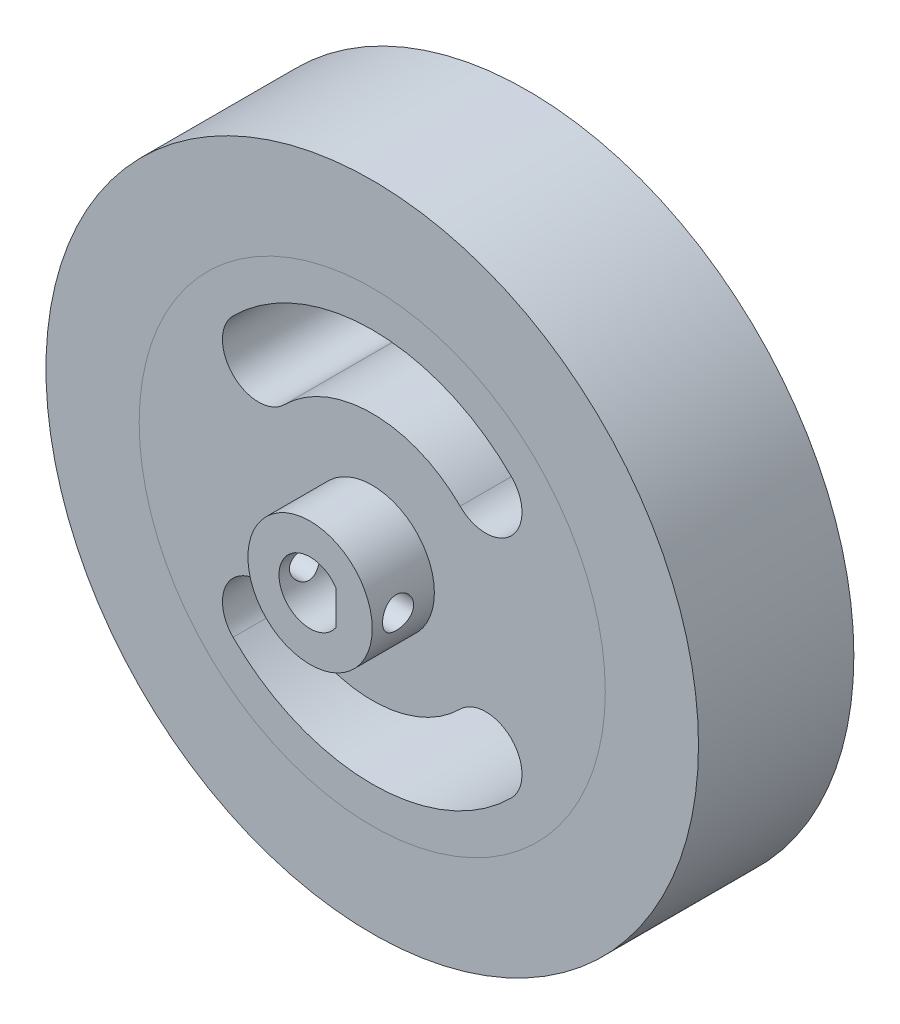
from build123d import *

# Parameters (mm, degrees)
SKETCH_1_R               = 31.5
EXTRUDE_1_DEPTH          = 15
SKETCH_3_R               = 3
CUT_EXTRUDE_2_DEPTH      = 48.005318848
SKETCH_14_R              = 6
SKETCH_14_R_2            = 3
EXTRUDE_3_DEPTH          = 6
EXTRUDE_START            = -21
EXTRUDE_4_DEPTH          = 21
CUT_EXTRUDE_3_DEPTH      = 50.249365478
CUT_EXTRUDE_3_DEPTH_BACK = 50.249365478
SKETCH_18_R              = 1.5
CUT_EXTRUDE_5_DEPTH      = 48.00531888
CUT_EXTRUDE_5_DEPTH_BACK = 48.00531888


with BuildPart() as part:
    # 草图1 → 凸台-拉伸1 (new body)
    with BuildSketch(Plane.XY):
        Circle(SKETCH_1_R)
    extrude(amount=EXTRUDE_1_DEPTH)

    # 草图3 → 切除-拉伸2 (cut, through all)
    with BuildSketch(Plane(origin=(0, 0, 0), x_dir=(-1, 0, 0), z_dir=(0, 0, -1))):
        Circle(SKETCH_3_R)
    extrude(amount=-CUT_EXTRUDE_2_DEPTH, mode=Mode.SUBTRACT)

    # 草图14 → 凸台-拉伸3 (add)
    with BuildSketch(Plane.XY.offset(15)):
        Circle(SKETCH_14_R)
        with Locations(Location((0, 0, 0), (0, 0, 180))):
            Circle(SKETCH_14_R_2, mode=Mode.SUBTRACT)
    extrude(amount=EXTRUDE_3_DEPTH)

    # 草图19 → 凸台-拉伸4 (add)
    with BuildSketch(Plane.XY.offset(21).offset(EXTRUDE_START)):
        with BuildLine():
            Line((2.5, 1.658312395), (2.5, -1.658312395))
            ThreePointArc((2.5, -1.658312395), (3, 0), (2.5, 1.658312395))
        make_face()
    extrude(amount=EXTRUDE_4_DEPTH)

    # 草图18 → 切除-拉伸3 (cut, two sides: drawn at the far end of the back side and taken through both)
    with BuildSketch(Plane(origin=(0, 0, 0), x_dir=(0, 0, -1), z_dir=(1, 0, 0)).offset(-CUT_EXTRUDE_3_DEPTH_BACK)):
        with Locations(Location((-18.5, 0, 0), (0, 0, 180))):
            Circle(SKETCH_18_R)
    extrude(amount=CUT_EXTRUDE_3_DEPTH + CUT_EXTRUDE_3_DEPTH_BACK, mode=Mode.SUBTRACT)

    # 草图20 → 切除-拉伸5 (cut, two sides: drawn at the far end of the back side and taken through both)
    with BuildSketch(Plane.XY.offset(15).offset(-CUT_EXTRUDE_5_DEPTH_BACK)):
        with BuildLine():
            ThreePointArc((8.485281374, 8.485281374), (0, 12), (-8.485281374, 8.485281374))
            ThreePointArc((-8.485281374, 8.485281374), (-13.435028843, 8.485281374), (-13.435028843, 13.435028843))
            ThreePointArc((-13.435028843, 13.435028843), (0, 19), (13.435028843, 13.435028843))
            ThreePointArc((13.435028843, 13.435028843), (13.435028843, 8.485281374), (8.485281374, 8.485281374))
        make_face()
        with BuildLine():
            ThreePointArc((8.485281374, -8.485281374), (13.435028843, -8.485281374), (13.435028843, -13.435028843))
            ThreePointArc((13.435028843, -13.435028843), (0, -19), (-13.435028843, -13.435028843))
            ThreePointArc((-13.435028843, -13.435028843), (-13.435028843, -8.485281374), (-8.485281374, -8.485281374))
            ThreePointArc((-8.485281374, -8.485281374), (0, -12), (8.485281374, -8.485281374))
        make_face()
    extrude(amount=CUT_EXTRUDE_5_DEPTH + CUT_EXTRUDE_5_DEPTH_BACK, mode=Mode.SUBTRACT)


solid = part.part
